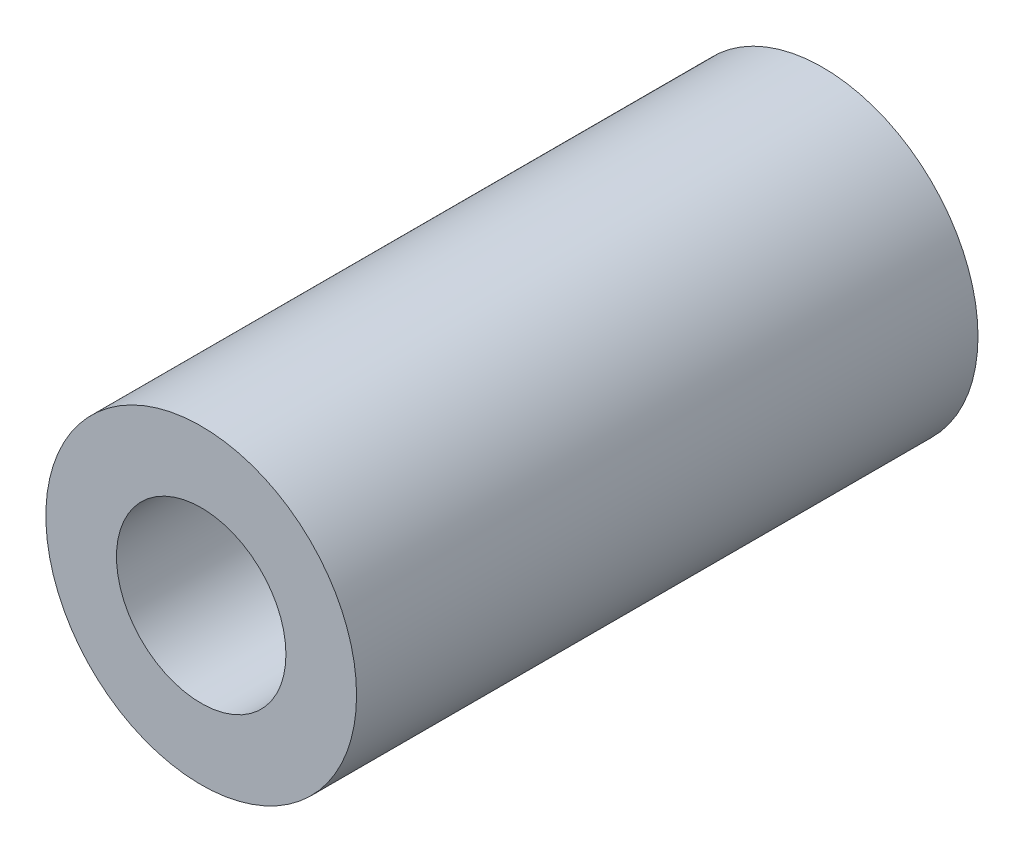
from build123d import *

# Parameters (mm, degrees)
SKETCH_1_R      = 2.75
SKETCH_1_R_2    = 1.5
EXTRUDE_1_DEPTH = 11


with BuildPart() as part:
    # Эскиз1 → Бобышка-Вытянуть1 (new body)
    with BuildSketch(Plane.XY):
        Circle(SKETCH_1_R)
        Circle(SKETCH_1_R_2, mode=Mode.SUBTRACT)
    extrude(amount=EXTRUDE_1_DEPTH)


solid = part.part
